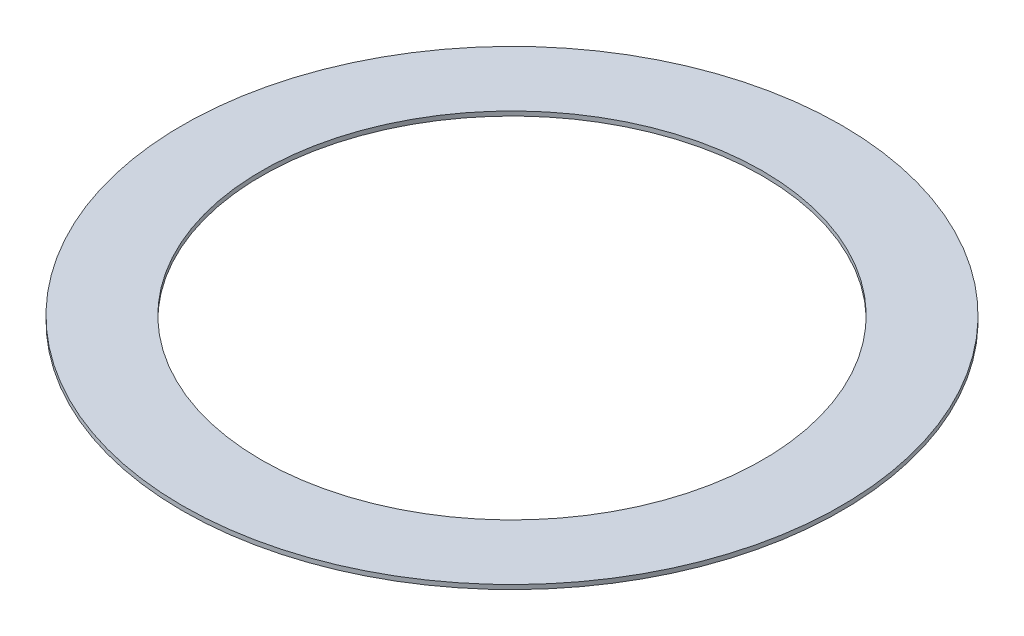
from build123d import *

# Parameters (mm, degrees)
SKETCH1_R           = 75
SKETCH1_R_2         = 57
BOSS_EXTRUDE1_DEPTH = 1


with BuildPart() as part:
    # Sketch1 → Boss-Extrude1 (new body)
    with BuildSketch(Plane(origin=(0, 0, 0), x_dir=(1, 0, 0), z_dir=(0, 1, 0))):
        with Locations(Location((0, 0, 0), (0, 0, 270))):
            Circle(SKETCH1_R)
        with Locations(Location((0, 0, 0), (0, 0, 270))):
            Circle(SKETCH1_R_2, mode=Mode.SUBTRACT)
    extrude(amount=BOSS_EXTRUDE1_DEPTH)


solid = part.part
